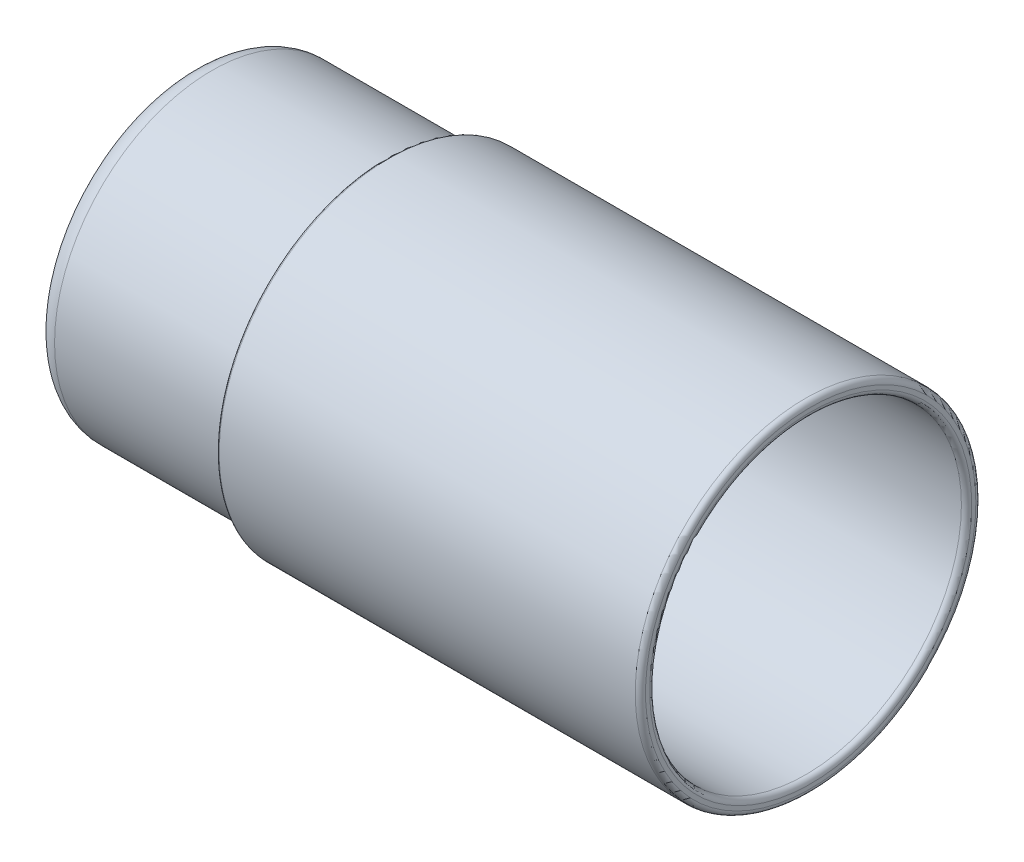
from build123d import *


with BuildPart() as part:
    # Sketch1 → Revolve1 (revolve)
    with BuildSketch(Plane(origin=(0, 0, 0), x_dir=(1, 0, 0), z_dir=(0, 1, 0))):
        with BuildLine():
            Line((0, 0), (0, 13.25))
            ThreePointArc((0, 13.25), (0.585786438, 14.664213562), (2, 15.25))
            Line((2, 15.25), (19, 15.25))
            Line((19, 15.25), (19, 16.3))
            ThreePointArc((19, 16.3), (19.058578644, 16.441421356), (19.2, 16.5))
            Line((19.2, 16.5), (59.5, 16.5))
            ThreePointArc((59.5, 16.5), (59.853553391, 16.353553391), (60, 16))
            Line((60, 16), (60, 15.6))
            ThreePointArc((60, 15.6), (59.853553391, 15.246446609), (59.5, 15.1))
            Line((59.5, 15.1), (32, 15.1))
            ThreePointArc((32, 15.1), (30.585786438, 14.514213562), (30, 13.1))
            Line((30, 13.1), (30, 0))
            Line((30, 0), (0, 0))
        make_face()
    revolve(axis=Axis((30, 0, 0), (-1, 0, 0)))


solid = part.part
